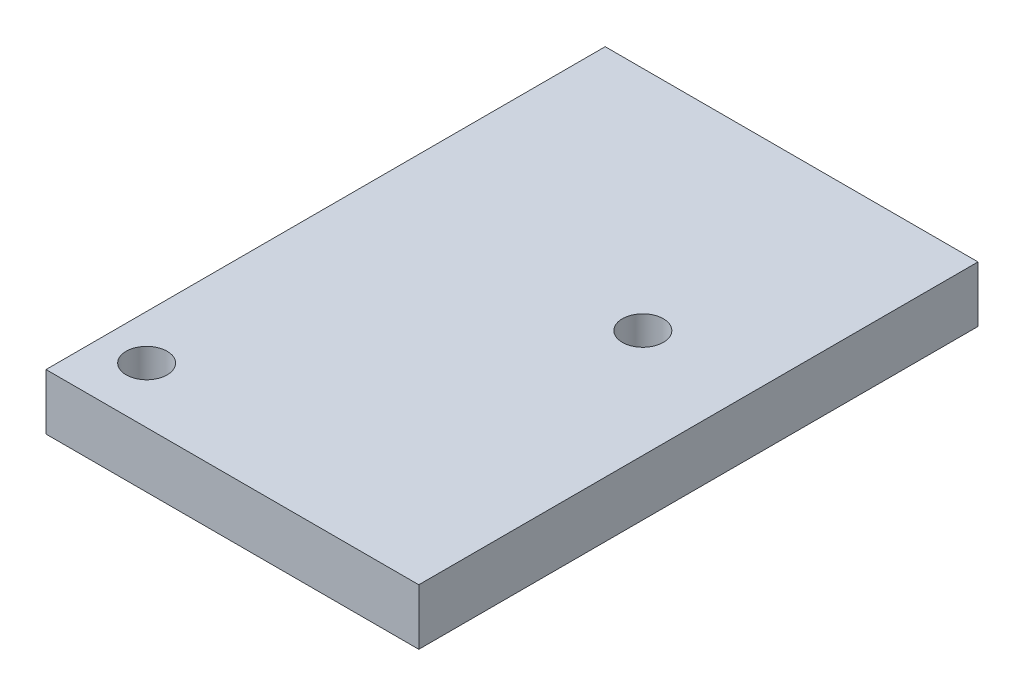
from build123d import *

# Parameters (mm, degrees)
SKETCH1_W  = 1000
SKETCH1_H  = 1500
BASE_DEPTH = 150
SKETCH2_R  = 55
AIR_DEPTH  = 1810.005251513
AIR2_D     = 110


with BuildPart() as part:
    # Sketch1 → base (new body)
    with BuildSketch(Plane(origin=(0, 0, 0), x_dir=(-1, 0, 0), z_dir=(0, 1, 0))):
        with Locations((500, 750)):
            Rectangle(SKETCH1_W, SKETCH1_H)
    extrude(amount=BASE_DEPTH)

    # Sketch2 → air (cut, through all)
    with BuildSketch(Plane(origin=(0, 150, 0), x_dir=(-1, 0, 0), z_dir=(0, 1, 0))):
        with Locations(Location((290, 609, 0), (0, 0, 90))):
            Circle(SKETCH2_R)
    extrude(amount=-AIR_DEPTH, mode=Mode.SUBTRACT)

    # air2 (through all)
    with Locations(Plane(origin=(0, 150, 0), x_dir=(1, 0, 0), z_dir=(0, 1, 0))):
        with Locations((-880, -1350)):
            Hole(AIR2_D / 2)


solid = part.part
